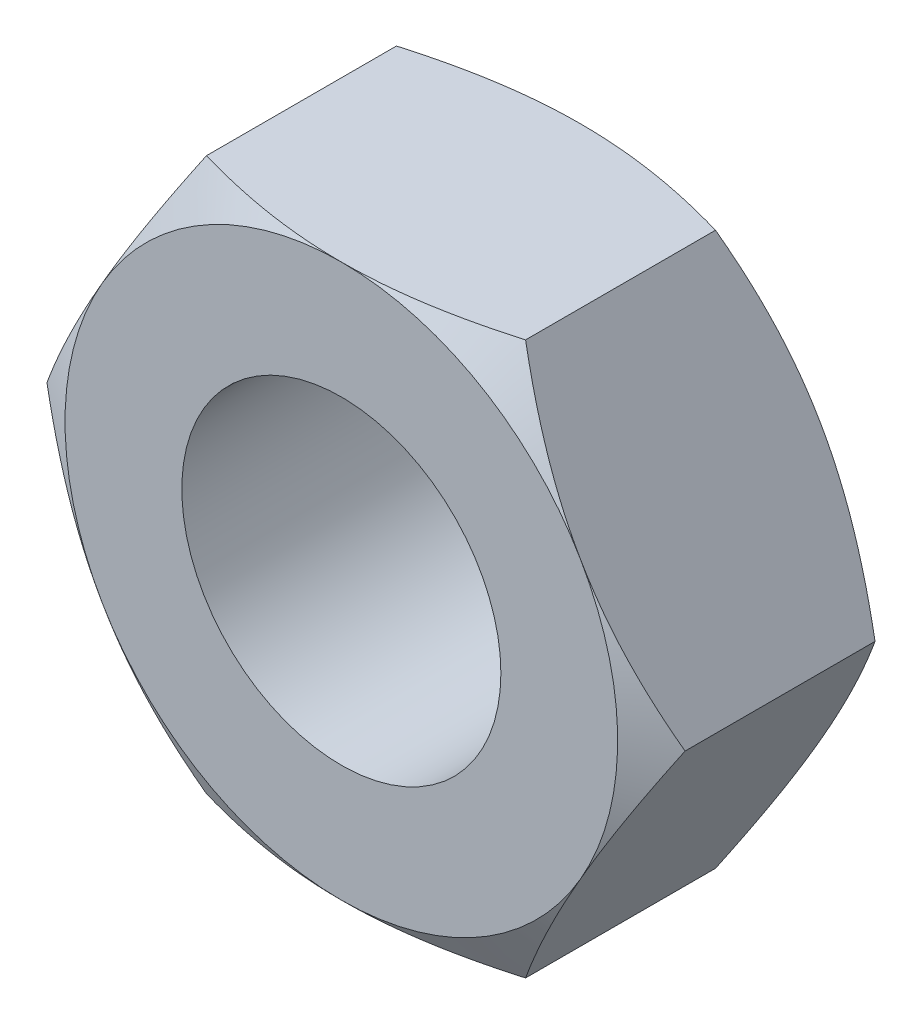
from build123d import *

# Parameters (mm, degrees)
SKETCH2_R               = 10
BOSS_EXTRUDE1_DEPTH     = 15
SKETCH3_OUTSIDE_W       = 104.962
SKETCH3_OUTSIDE_H       = 99.604
SKETCH3_OUTSIDE_R       = 17.320508076
CUT_EXTRUDE1_DEPTH      = 15
CUT_EXTRUDE1_DRAFT      = -60
MIRROR1_COPY_1_SKETCH_W = 104.962
MIRROR1_COPY_1_SKETCH_H = 99.604
MIRROR1_COPY_1_SKETCH_R = 17.320508076
MIRROR1_COPY_1_DEPTH    = 15
MIRROR1_COPY_1_DRAFT    = -60


with BuildPart() as part:
    # Sketch2 → Boss-Extrude1 (new body)
    with BuildSketch(Plane.XY):
        Polygon((20, 0), (10, 17.320508076), (-10, 17.320508076), (-20, 0), (-10, -17.320508076), (10, -17.320508076), align=None)
        Circle(SKETCH2_R, mode=Mode.SUBTRACT)
    extrude(amount=BOSS_EXTRUDE1_DEPTH)


with BuildPart() as cut_extrude1_tool:
    # Sketch3 outside → Cut-Extrude1 (with draft: the straight prism first)
    with BuildSketch(Plane(origin=(0, 0, 0), x_dir=(-1, 0, 0), z_dir=(0, 0, -1))):
        Rectangle(SKETCH3_OUTSIDE_W, SKETCH3_OUTSIDE_H)
        Circle(SKETCH3_OUTSIDE_R, mode=Mode.SUBTRACT)
    extrude(amount=-CUT_EXTRUDE1_DEPTH)
    # Cut-Extrude1: the draft: its side faces are tilted about the plane it starts from
    cut_extrude1_sides = [cut_extrude1_tool.faces().sort_by_distance(p)[0] for p in [
        (0, -49.802, 7.5),
        (-52.481, 0, 7.5),
        (0, 49.802, 7.5),
        (52.481, 0, 7.5),
        (17.320508076, 0, 7.5),
    ]]
    draft(cut_extrude1_sides, Plane(origin=(0, 0, 0), x_dir=(-1, 0, 0), z_dir=(0, 0, -1)), CUT_EXTRUDE1_DRAFT)


with BuildPart() as part_1:
    add(part.part)

    # Cut-Extrude1: cut by cut_extrude1_tool
    add(cut_extrude1_tool.part, mode=Mode.SUBTRACT)


with BuildPart() as mirror1_copy_1_tool:
    # Mirror1 copy 1 sketch → Mirror1 copy 1 (with draft: the straight prism first)
    with BuildSketch(Plane(origin=(0, 0, 15), x_dir=(-1, 0, 0), z_dir=(0, 0, 1))):
        Rectangle(MIRROR1_COPY_1_SKETCH_W, MIRROR1_COPY_1_SKETCH_H)
        Circle(MIRROR1_COPY_1_SKETCH_R, mode=Mode.SUBTRACT)
    extrude(amount=-MIRROR1_COPY_1_DEPTH)
    # Mirror1 copy 1: the draft: its side faces are tilted about the plane it starts from
    mirror1_copy_1_sides = [mirror1_copy_1_tool.faces().sort_by_distance(p)[0] for p in [
        (0, -49.802, 7.5),
        (-52.481, 0, 7.5),
        (0, 49.802, 7.5),
        (52.481, 0, 7.5),
        (17.320508076, 0, 7.5),
    ]]
    draft(mirror1_copy_1_sides, Plane(origin=(0, 0, 15), x_dir=(-1, 0, 0), z_dir=(0, 0, 1)), MIRROR1_COPY_1_DRAFT)


with BuildPart() as part_2:
    add(part_1.part)

    # Mirror1 copy 1: cut by mirror1_copy_1_tool
    add(mirror1_copy_1_tool.part, mode=Mode.SUBTRACT)


solid = part_2.part
